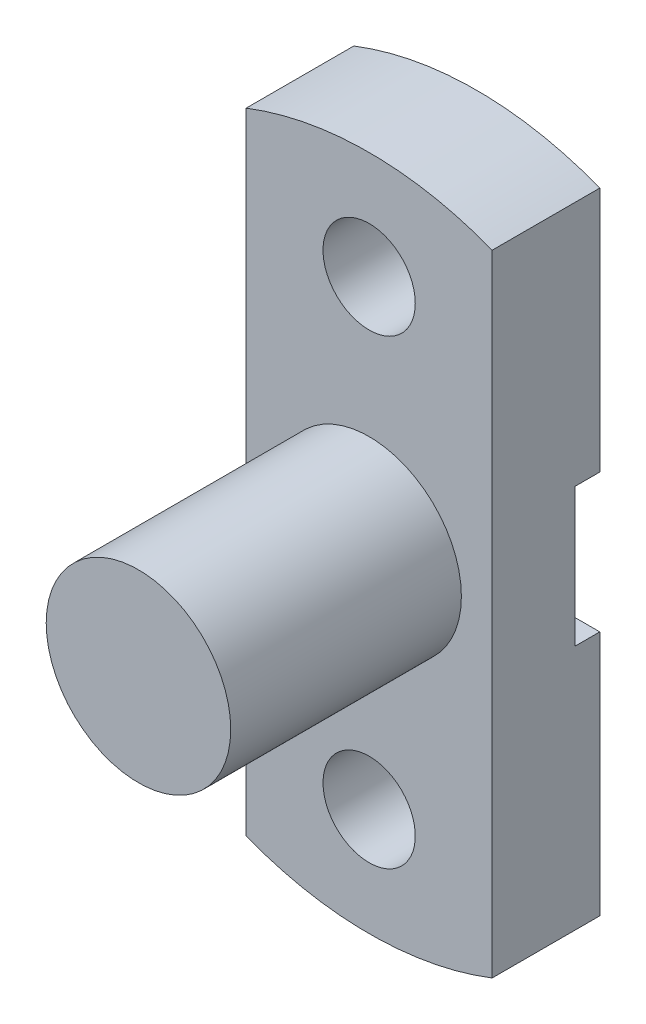
from build123d import *

# Parameters (mm, degrees)
SKETCH1_R           = 15
BOSS_EXTRUDE2_DEPTH = 35
SKETCH2_R           = 30
BOSS_EXTRUDE3_DEPTH = 75
SKETCH3_W           = 8
SKETCH3_H           = 45
CUT_EXTRUDE1_DEPTH  = 175.928556845


with BuildPart() as part:
    # Sketch1 → Boss-Extrude2 (new body)
    with BuildSketch(Plane.XY):
        with BuildLine():
            Line((-40, 102.46950766), (-40, -102.46950766))
            ThreePointArc((-40, -102.46950766), (0, -110), (40, -102.46950766))
            Line((40, -102.46950766), (40, 102.46950766))
            ThreePointArc((40, 102.46950766), (0, 110), (-40, 102.46950766))
        make_face()
        with Locations((0, 75)):
            Circle(SKETCH1_R, mode=Mode.SUBTRACT)
        with Locations(Location((0, -75, 0), (0, 0, 180))):
            Circle(SKETCH1_R, mode=Mode.SUBTRACT)
    extrude(amount=BOSS_EXTRUDE2_DEPTH)

    # Sketch2 → Boss-Extrude3 (add)
    with BuildSketch(Plane.XY.offset(35)):
        Circle(SKETCH2_R)
    extrude(amount=BOSS_EXTRUDE3_DEPTH)

    # Sketch3 → Cut-Extrude1 (cut, through all)
    with BuildSketch(Plane.ZY.offset(40)):
        with Locations((4, 0)):
            Rectangle(SKETCH3_W, SKETCH3_H)
    extrude(amount=-CUT_EXTRUDE1_DEPTH, mode=Mode.SUBTRACT)


solid = part.part
